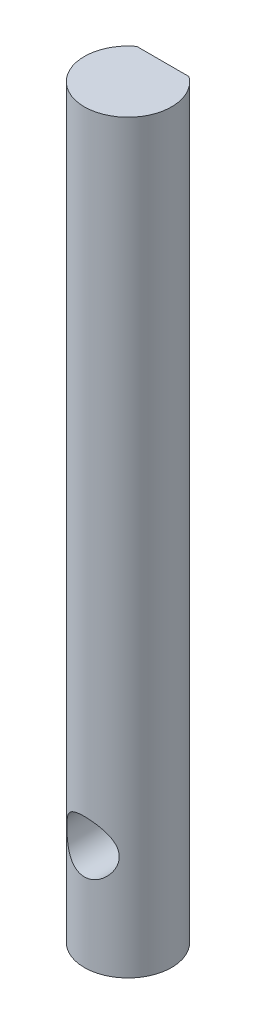
from build123d import *

# Parameters (mm, degrees)
BOSS_EXTRUDE1_DEPTH     = 42.7
CUT_EXTRUDE1_DEPTH      = 44.009185066
CUT_EXTRUDE1_DEPTH_BACK = 44.009185066
SKETCH2_R               = 1.5


with BuildPart() as part:
    # Sketch1 → Boss-Extrude1 (new body)
    with BuildSketch(Plane(origin=(0, 0, 0), x_dir=(1, 0, 0), z_dir=(0, 1, 0))):
        with BuildLine():
            Line((1.5, 2), (-1.5, 2))
            ThreePointArc((-1.5, 2), (-1.118033989, -2.236067977), (2.5, 0))
            ThreePointArc((2.5, 0), (2.236067977, 1.118033989), (1.5, 2))
        make_face()
    extrude(amount=BOSS_EXTRUDE1_DEPTH)

    # Sketch2 → Cut-Extrude1 (cut, two sides: drawn at the far end of the back side and taken through both)
    with BuildSketch(Plane(origin=(0, 0, -2), x_dir=(-1, 0, 0), z_dir=(0, 0, -1)).offset(-CUT_EXTRUDE1_DEPTH_BACK)):
        with Locations((0, 6)):
            Circle(SKETCH2_R)
    extrude(amount=CUT_EXTRUDE1_DEPTH + CUT_EXTRUDE1_DEPTH_BACK, mode=Mode.SUBTRACT)


solid = part.part
